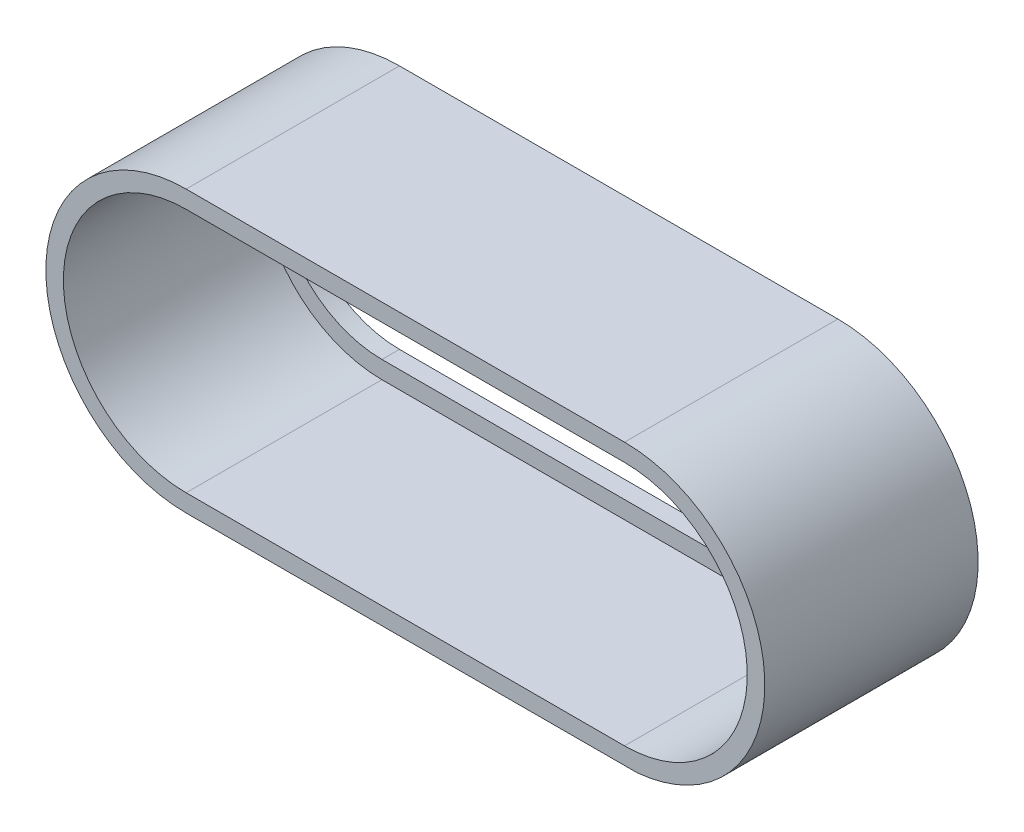
from build123d import *

# Parameters (mm, degrees)
BOSS_EXTRUDE2_DEPTH = 3
BOSS_EXTRUDE3_DEPTH = 33.5
CUT_EXTRUDE1_DEPTH  = 3


with BuildPart() as part:
    # Sketch1 → Boss-Extrude2 (new body)
    with BuildSketch(Plane.XY):
        with BuildLine():
            ThreePointArc((-37.5, 24), (-61.5, 0), (-37.5, -24))
            Line((-37.5, -24), (39.664725273, -23.90217489))
            ThreePointArc((39.664725273, -23.90217489), (61.475531249, 1.083467265), (37.5, 24))
            Line((37.5, 24), (-37.5, 24))
        make_face()
    extrude(amount=BOSS_EXTRUDE2_DEPTH)

    # Sketch3 → Boss-Extrude3 (add)
    with BuildSketch(Plane.XY.offset(3)):
        with BuildLine():
            ThreePointArc((-37.5, 24), (-61.5, 0), (-37.5, -24))
            Line((-37.5, -24), (39.664725273, -23.90217489))
            ThreePointArc((39.664725273, -23.90217489), (61.475531249, 1.083467265), (37.5, 24))
            Line((37.5, 24), (-37.5, 24))
        make_face()
        with BuildLine():
            ThreePointArc((-37.5, -21), (-58.5, 0), (-37.5, 21))
            Line((-37.5, 21), (37.5, 21))
            ThreePointArc((37.5, 21), (58.5, 0), (37.5, -21))
            Line((37.5, -21), (-37.5, -21))
        make_face(mode=Mode.SUBTRACT)
    extrude(amount=BOSS_EXTRUDE3_DEPTH)

    # Sketch4 → Cut-Extrude1 (cut)
    with BuildSketch(Plane(origin=(0, 0, 0), x_dir=(-1, 0, 0), z_dir=(0, 0, -1))):
        with BuildLine():
            ThreePointArc((-37.5, 18), (-55.5, 0), (-37.5, -18))
            Line((-37.5, -18), (37.5, -18))
            ThreePointArc((37.5, -18), (55.5, 0), (37.5, 18))
            Line((37.5, 18), (-37.5, 18))
        make_face()
    extrude(amount=-CUT_EXTRUDE1_DEPTH, mode=Mode.SUBTRACT)


solid = part.part
